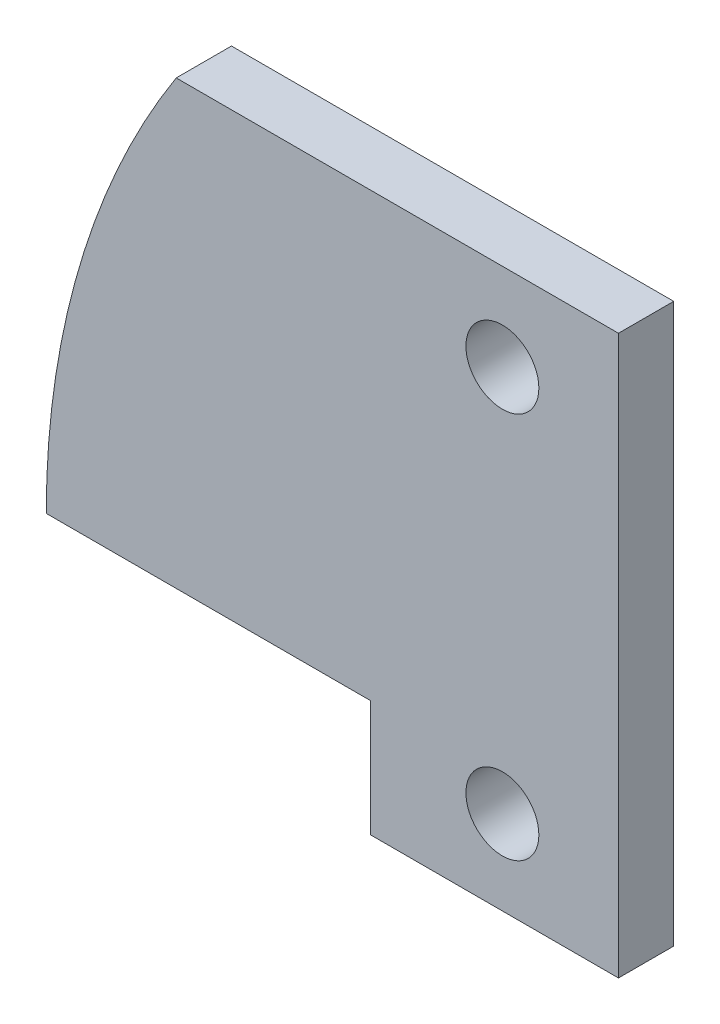
from build123d import *

# Parameters (mm, degrees)
SKETCH1_R           = 1.65
BOSS_EXTRUDE1_DEPTH = 2.5


with BuildPart() as part:
    # Sketch1 → Boss-Extrude1 (new body)
    with BuildSketch(Plane.XY):
        with BuildLine():
            Line((-8.004553297, 23.25769142), (12, 23.25769142))
            Line((12, 23.25769142), (12, 0))
            Line((12, 0), (12, -2))
            Line((12, -2), (0.775731814, -2))
            Line((0.775731814, -2), (0.775731814, 0))
            Line((0.775731814, 0), (0.775731814, 3.25769142))
            Line((0.775731814, 3.25769142), (-13.882660061, 3.25769142))
            ThreePointArc((-13.882660061, 3.25769142), (-12.382699641, 13.680648524), (-8.004553297, 23.25769142))
        make_face()
        with Locations((6.74921921, 19.306101501)):
            Circle(SKETCH1_R, mode=Mode.SUBTRACT)
        with Locations((6.74921921, 1.806101501)):
            Circle(SKETCH1_R, mode=Mode.SUBTRACT)
    extrude(amount=BOSS_EXTRUDE1_DEPTH)


solid = part.part
